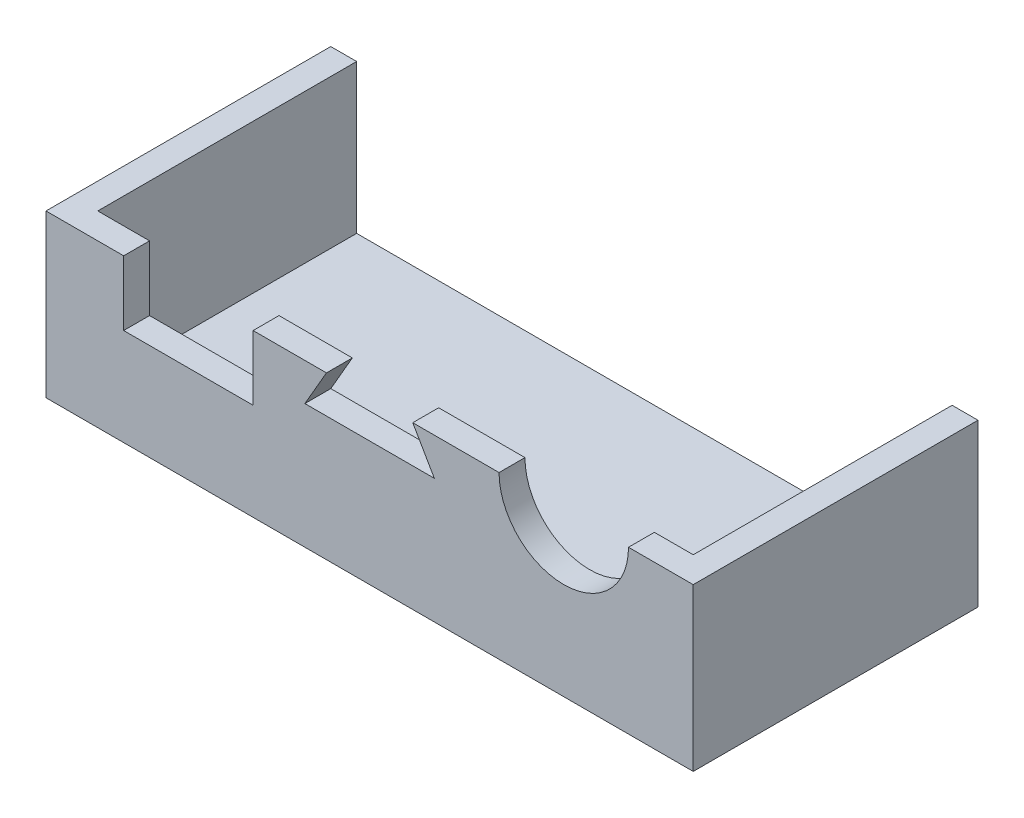
from build123d import *

# Parameters (mm, degrees)
SKETCH1_W               = 250
SKETCH1_H               = 125
SKETCH1_W_2             = 230
SKETCH1_H_2             = 115
BOSS_EXTRUDE1_DEPTH     = 100
SKETCH3_W               = 250
SKETCH3_H               = 125
SKETCH3_W_2             = 230
SKETCH3_H_2             = 115
SKETCH3_R               = 25
SKETCH3_W_3             = 50
SKETCH3_H_3             = 50
BOSS_EXTRUDE4_DEPTH     = 10
CUT_EXTRUDE1_DEPTH      = 178.851764118
CUT_EXTRUDE1_DEPTH_BACK = 178.851764118


with BuildPart() as part:
    # Sketch1 → Boss-Extrude1 (new body)
    with BuildSketch(Plane.XY):
        Rectangle(SKETCH1_W, SKETCH1_H)
        Rectangle(SKETCH1_W_2, SKETCH1_H_2, mode=Mode.SUBTRACT)
    extrude(amount=BOSS_EXTRUDE1_DEPTH)

    # Sketch3 → Boss-Extrude4 (add)
    # profile 1 of 2: a face of its own
    with BuildSketch(Plane.XY.offset(100)):
        Rectangle(SKETCH3_W, SKETCH3_H)
        Rectangle(SKETCH3_W_2, SKETCH3_H_2, mode=Mode.SUBTRACT)
    # profile 2 of 2: a face of its own
    with BuildSketch(Plane.XY.offset(100)):
        Rectangle(SKETCH3_W_2, SKETCH3_H_2)
        with Locations((75, 0)):
            Circle(SKETCH3_R, mode=Mode.SUBTRACT)
        with Locations((-70, 0)):
            Rectangle(SKETCH3_W_3, SKETCH3_H_3, mode=Mode.SUBTRACT)
        Polygon((0, 28.867513459), (25, -14.43375673), (-25, -14.43375673), align=None, mode=Mode.SUBTRACT)
    extrude(amount=BOSS_EXTRUDE4_DEPTH)

    # Sketch4 → Cut-Extrude1 (cut, two sides: drawn at the far end of the back side and taken through both)
    with BuildSketch(Plane.XY.offset(-CUT_EXTRUDE1_DEPTH_BACK)):
        Polygon((-709.844547741, 0), (-138.233831443, 0), (148.761573573, 0), (720.372289871, 0), (720.372289871, 1143.221432596), (-709.844547741, 1143.221432596), align=None)
    extrude(amount=CUT_EXTRUDE1_DEPTH + CUT_EXTRUDE1_DEPTH_BACK, mode=Mode.SUBTRACT)


solid = part.part
